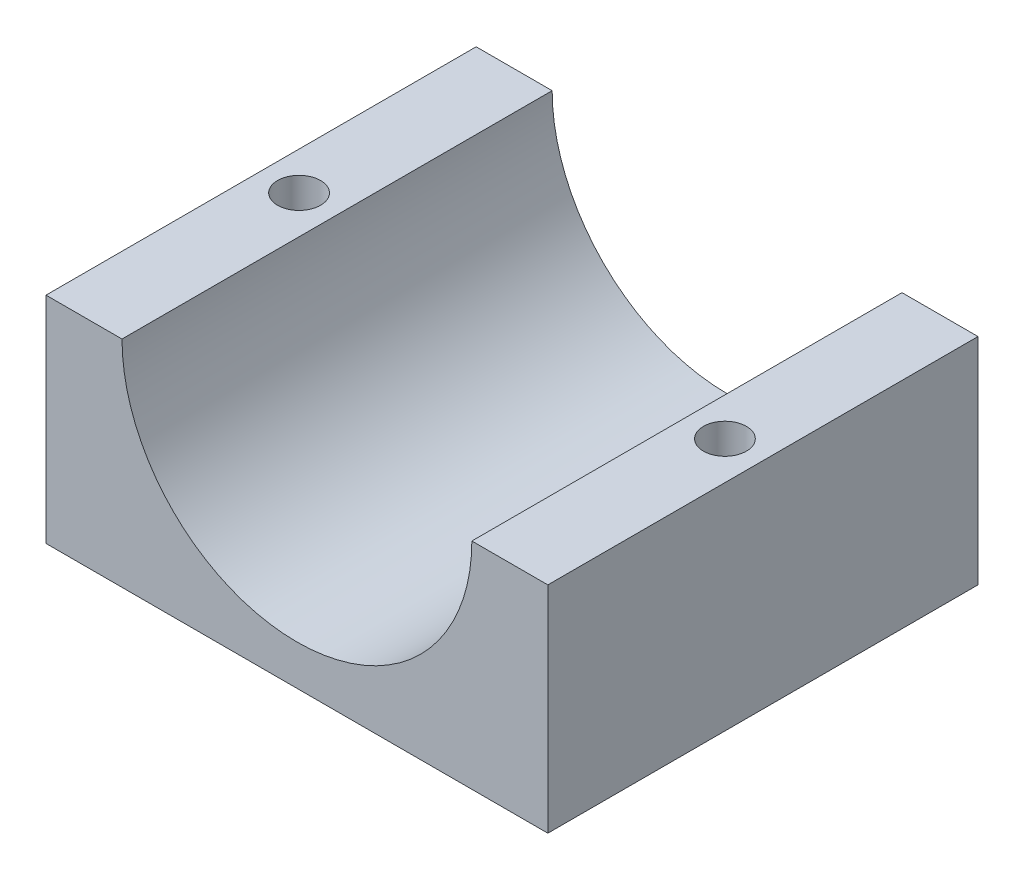
from build123d import *

# Parameters (mm, degrees)
SKETCH1_W             = 35
SKETCH1_H             = 30
BOSS_EXTRUDE1_DEPTH   = 15
CUT_EXTRUDE1_REACH    = 39.832
SKETCH2_R             = 12.2
F_3_0MM_DOWEL_HOLE1_D = 3


with BuildPart() as part:
    # Sketch1 → Boss-Extrude1 (new body)
    with BuildSketch(Plane(origin=(0, 0, 0), x_dir=(1, 0, 0), z_dir=(0, 1, 0))):
        Rectangle(SKETCH1_W, SKETCH1_H)
    extrude(amount=BOSS_EXTRUDE1_DEPTH)

    # Sketch2 → Cut-Extrude1 (cut, up to next)
    with BuildSketch(Plane.XY.offset(15), mode=Mode.PRIVATE) as cut_extrude1_sk1:
        with Locations((0, 15)):
            Circle(SKETCH2_R)
    cut_extrude1_tool1 = extrude(cut_extrude1_sk1.sketch, amount=-CUT_EXTRUDE1_REACH, mode=Mode.PRIVATE) & part.part
    add(cut_extrude1_tool1.solids().sort_by_distance((0, 15, 15))[0], mode=Mode.SUBTRACT)

    # Ø3.0mm Dowel Hole1 (through all)
    with Locations(Plane(origin=(-14.85, 15, 0), x_dir=(0, 0, 1), z_dir=(0, 1, 0))):
        with Locations((0, 0), (0, 29.7)):
            Hole(F_3_0MM_DOWEL_HOLE1_D / 2)


solid = part.part
